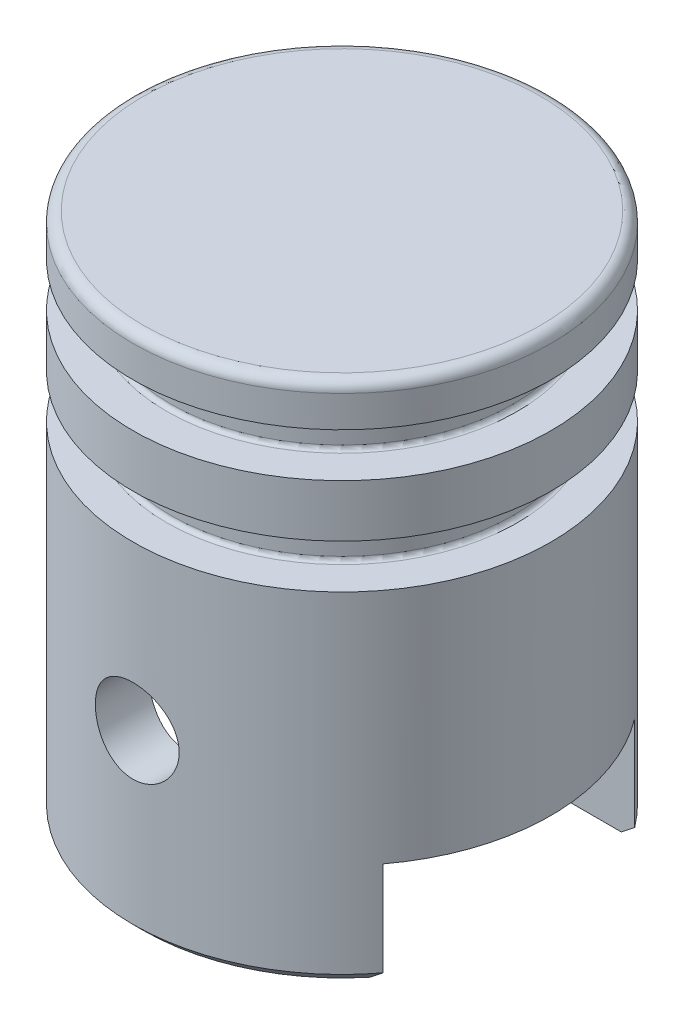
from build123d import *

# Parameters (mm, degrees)
SKETCH_1_R               = 9.97
EXTRUDE_1_DEPTH          = 25
FILLET_1_R               = 0.5
SKETCH_2_W               = 1.8
SKETCH_2_H               = 2.1
FILLET_2_R               = 0.2
CUT_EXTRUDE_1_DEPTH      = 29.701947669
CUT_EXTRUDE_1_DEPTH_BACK = 29.701947669
SKETCH_4_R               = 2
CHAMFER_1_SIZE           = 0.5
CUT_EXTRUDE_4_DEPTH      = 29.701947739
CUT_EXTRUDE_4_DEPTH_BACK = 29.701947739
SKETCH_7_W               = 12
SKETCH_7_H               = 5
CUT_EXTRUDE_START        = 5
SKETCH_8_R               = 7.5
CUT_EXTRUDE_5_DEPTH      = 24


with BuildPart() as part:
    # 草图1 → 凸台-拉伸1 (new body)
    with BuildSketch(Plane(origin=(0, 0, 0), x_dir=(1, 0, 0), z_dir=(0, 1, 0))):
        Circle(SKETCH_1_R)
    extrude(amount=EXTRUDE_1_DEPTH)

    # 圆角1
    fillet_1_edges = [part.edges().sort_by_distance(p)[0] for p in [
        (-9.97, 25, 0),
    ]]
    fillet(fillet_1_edges, radius=FILLET_1_R)

    # 草图2 → 切除-旋转1 (revolve, cut)
    with BuildSketch(Plane.XY):
        with Locations((-9.07, 21.95)):
            Rectangle(SKETCH_2_W, SKETCH_2_H)
        with Locations((-9.07, 17.35)):
            Rectangle(SKETCH_2_W, SKETCH_2_H)
    revolve(axis=Axis((0, 0, 0), (0, 1, 0)), mode=Mode.SUBTRACT)

    # 圆角2
    fillet_2_edges = [part.edges().sort_by_distance(p)[0] for p in [
        (8.17, 16.3, 0),
        (8.17, 18.4, 0),
        (8.17, 20.9, 0),
        (8.17, 23, 0),
    ]]
    fillet(fillet_2_edges, radius=FILLET_2_R)

    # 草图4 → 切除-拉伸1 (cut, two sides: drawn at the far end of the back side and taken through both)
    with BuildSketch(Plane.XY.offset(-CUT_EXTRUDE_1_DEPTH_BACK)):
        with Locations((0, 8.5)):
            Circle(SKETCH_4_R)
    extrude(amount=CUT_EXTRUDE_1_DEPTH + CUT_EXTRUDE_1_DEPTH_BACK, mode=Mode.SUBTRACT)

    # 倒角1
    chamfer_1_edges = [part.edges().sort_by_distance(p)[0] for p in [
        (-9.97, 0, 0),
    ]]
    chamfer(chamfer_1_edges, length=CHAMFER_1_SIZE)

    # 草图7 → 切除-拉伸4 (cut, two sides: drawn at the far end of the back side and taken through both)
    with BuildSketch(Plane(origin=(0, 0, 0), x_dir=(0, 0, -1), z_dir=(1, 0, 0)).offset(-CUT_EXTRUDE_4_DEPTH_BACK)):
        with Locations((0, 2.5)):
            Rectangle(SKETCH_7_W, SKETCH_7_H)
    extrude(amount=CUT_EXTRUDE_4_DEPTH + CUT_EXTRUDE_4_DEPTH_BACK, mode=Mode.SUBTRACT)

    # 草图8 → 切除-拉伸5 (cut)
    with BuildSketch(Plane.XZ.offset(-5).offset(CUT_EXTRUDE_START)):
        Circle(SKETCH_8_R)
    extrude(amount=-CUT_EXTRUDE_5_DEPTH, mode=Mode.SUBTRACT)


solid = part.part
